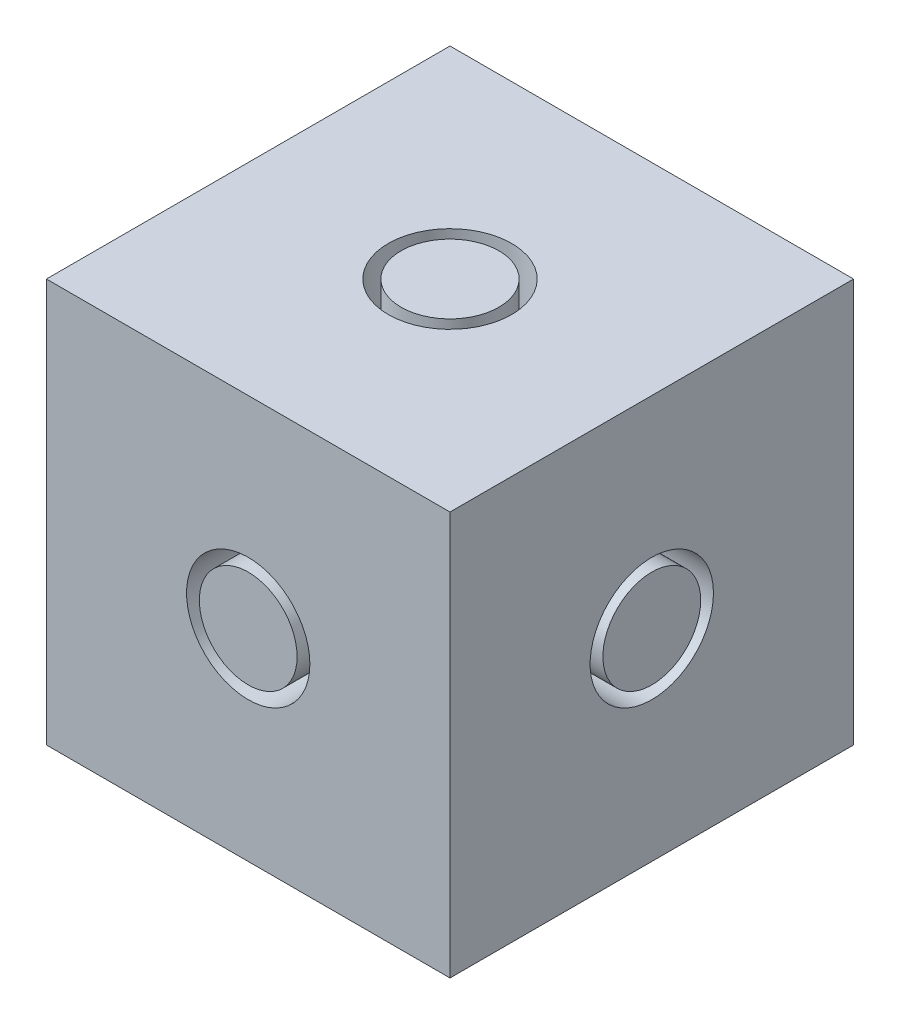
from build123d import *

# Parameters (mm, degrees)
SKETCH1_W           = 55.3
SKETCH1_H           = 55.3
BOSS_EXTRUDE1_DEPTH = 27.65
SKETCH2_R           = 8.45
SKETCH2_R_2         = 6.7
CUT_EXTRUDE2_DEPTH  = 9.5
CUT_EXTRUDE3_START  = -9.5
SKETCH3_R           = 8.45
SKETCH3_R_2         = 6.7
CUT_EXTRUDE3_DEPTH  = 9.5
SKETCH4_R           = 8.45
SKETCH4_R_2         = 6.7
CUT_EXTRUDE4_DEPTH  = 9.5
CUT_EXTRUDE5_START  = -9.5
SKETCH5_R           = 8.45
SKETCH5_R_2         = 6.7
CUT_EXTRUDE5_DEPTH  = 9.5
SKETCH6_R           = 8.45
SKETCH6_R_2         = 6.7
CUT_EXTRUDE6_DEPTH  = 9.5
CUT_EXTRUDE7_START  = -9.5
SKETCH7_R           = 8.45
SKETCH7_R_2         = 6.7
CUT_EXTRUDE7_DEPTH  = 9.5


with BuildPart() as part:
    # Sketch1 → Boss-Extrude1 (new, symmetric)
    with BuildSketch(Plane(origin=(0, 0, 0), x_dir=(1, 0, 0), z_dir=(0, 1, 0))):
        Rectangle(SKETCH1_W, SKETCH1_H)
    extrude(amount=BOSS_EXTRUDE1_DEPTH, both=True)

    # Sketch2 → Cut-Extrude2 (cut)
    with BuildSketch(Plane(origin=(0, 27.65, 0), x_dir=(1, 0, 0), z_dir=(0, 1, 0))):
        with Locations(Location((0, 0, 0), (0, 0, 270))):
            Circle(SKETCH2_R)
        with Locations(Location((0, 0, 0), (0, 0, 270))):
            Circle(SKETCH2_R_2, mode=Mode.SUBTRACT)
    extrude(amount=-CUT_EXTRUDE2_DEPTH, mode=Mode.SUBTRACT)

    # Sketch3 → Cut-Extrude3 (cut)
    with BuildSketch(Plane.XZ.offset(27.65).offset(CUT_EXTRUDE3_START)):
        with Locations(Location((0, 0, 0), (0, 0, 90))):
            Circle(SKETCH3_R)
        with Locations(Location((0, 0, 0), (0, 0, 90))):
            Circle(SKETCH3_R_2, mode=Mode.SUBTRACT)
    extrude(amount=CUT_EXTRUDE3_DEPTH, mode=Mode.SUBTRACT)

    # Sketch4 → Cut-Extrude4 (cut)
    with BuildSketch(Plane(origin=(27.65, 0, 0), x_dir=(0, 0, -1), z_dir=(1, 0, 0))):
        Circle(SKETCH4_R)
        Circle(SKETCH4_R_2, mode=Mode.SUBTRACT)
    extrude(amount=-CUT_EXTRUDE4_DEPTH, mode=Mode.SUBTRACT)

    # Sketch5 → Cut-Extrude5 (cut)
    with BuildSketch(Plane.ZY.offset(27.65).offset(CUT_EXTRUDE5_START)):
        with Locations(Location((0, 0, 0), (0, 0, 180))):
            Circle(SKETCH5_R)
        with Locations(Location((0, 0, 0), (0, 0, 180))):
            Circle(SKETCH5_R_2, mode=Mode.SUBTRACT)
    extrude(amount=CUT_EXTRUDE5_DEPTH, mode=Mode.SUBTRACT)

    # Sketch6 → Cut-Extrude6 (cut)
    with BuildSketch(Plane.XY.offset(27.65)):
        Circle(SKETCH6_R)
        Circle(SKETCH6_R_2, mode=Mode.SUBTRACT)
    extrude(amount=-CUT_EXTRUDE6_DEPTH, mode=Mode.SUBTRACT)

    # Sketch7 → Cut-Extrude7 (cut)
    with BuildSketch(Plane(origin=(0, 0, -27.65), x_dir=(-1, 0, 0), z_dir=(0, 0, -1)).offset(CUT_EXTRUDE7_START)):
        with Locations(Location((0, 0, 0), (0, 0, 180))):
            Circle(SKETCH7_R)
        with Locations(Location((0, 0, 0), (0, 0, 180))):
            Circle(SKETCH7_R_2, mode=Mode.SUBTRACT)
    extrude(amount=CUT_EXTRUDE7_DEPTH, mode=Mode.SUBTRACT)


solid = part.part
